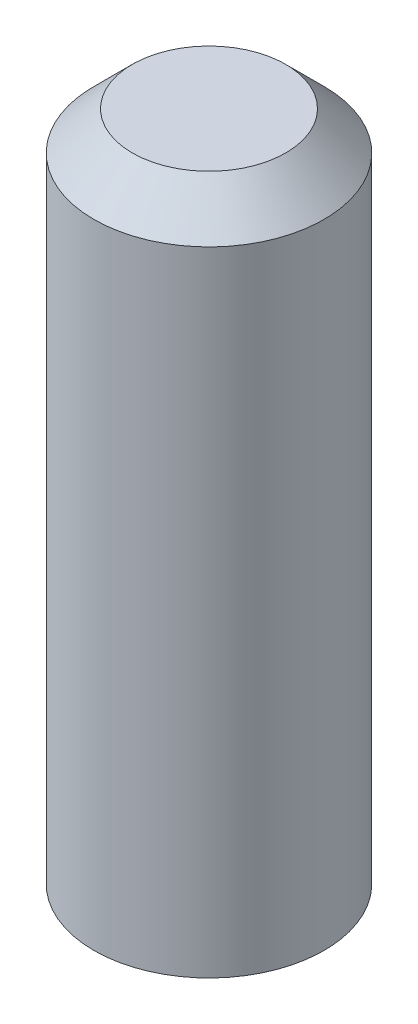
from build123d import *

# Parameters (mm, degrees)
ESBO_O1_R                = 6
RESSALTO_EXTRUS_O1_DEPTH = 35
CHANFRO1_SIZE            = 2
ESBO_O2_R                = 3.4
CORTE_EXTRUS_O1_DEPTH    = 25


with BuildPart() as part:
    # Esboço1 → Ressalto-extrusão1 (new body)
    with BuildSketch(Plane(origin=(0, 0, 0), x_dir=(1, 0, 0), z_dir=(0, 1, 0))):
        with Locations(Location((0, 0, 0), (0, 0, 270))):
            Circle(ESBO_O1_R)
    extrude(amount=RESSALTO_EXTRUS_O1_DEPTH)

    # Chanfro1
    chanfro1_edges = [part.edges().sort_by_distance(p)[0] for p in [
        (0, 35, -6),
    ]]
    chamfer(chanfro1_edges, length=CHANFRO1_SIZE)

    # Esboço2 → Corte-extrusão1 (cut)
    with BuildSketch(Plane.XZ):
        with Locations(Location((0, 0, 0), (0, 0, 270))):
            Circle(ESBO_O2_R)
    extrude(amount=-CORTE_EXTRUS_O1_DEPTH, mode=Mode.SUBTRACT)


solid = part.part
